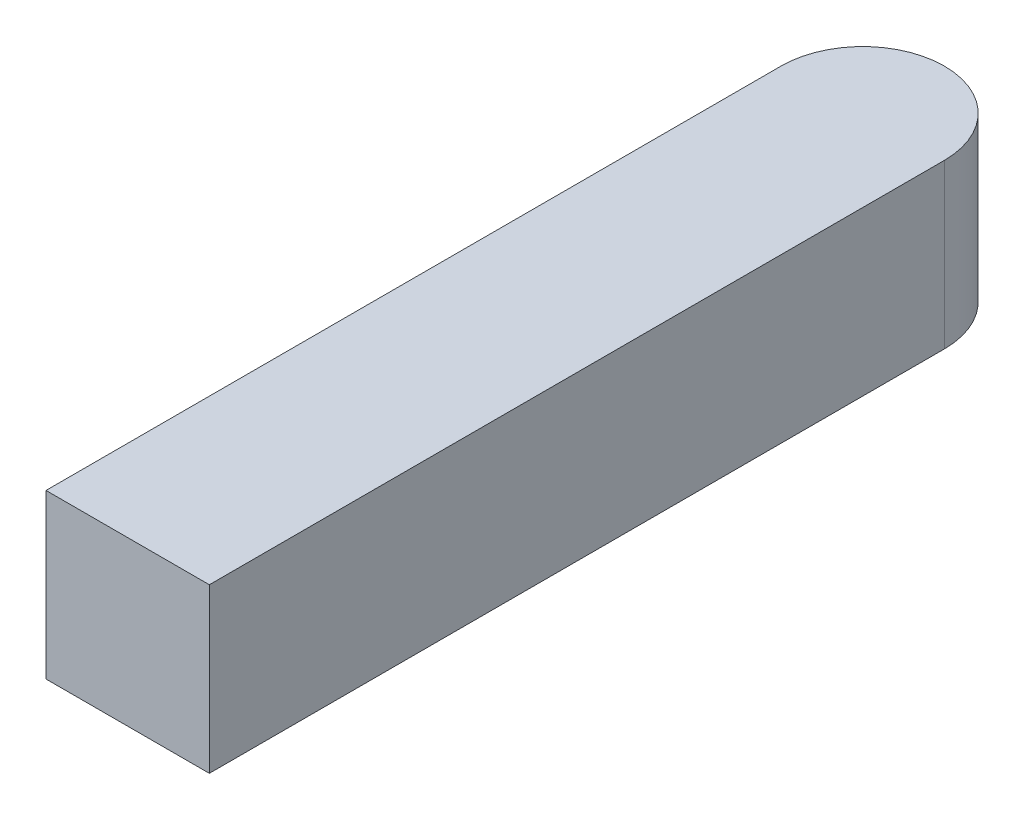
from build123d import *

# Parameters (mm, degrees)
BOSS_EXTRUDE1_DEPTH = 1.5


with BuildPart() as part:
    # Sketch2 → Boss-Extrude1 (new, symmetric)
    with BuildSketch(Plane(origin=(0, 0, 0), x_dir=(1, 0, 0), z_dir=(0, 1, 0))):
        with BuildLine():
            Line((-1.5, 6.75), (-1.5, -6.75))
            Line((-1.5, -6.75), (1.5, -6.75))
            Line((1.5, -6.75), (1.5, 6.75))
            ThreePointArc((1.5, 6.75), (0, 8.25), (-1.5, 6.75))
        make_face()
    extrude(amount=BOSS_EXTRUDE1_DEPTH, both=True)


solid = part.part
